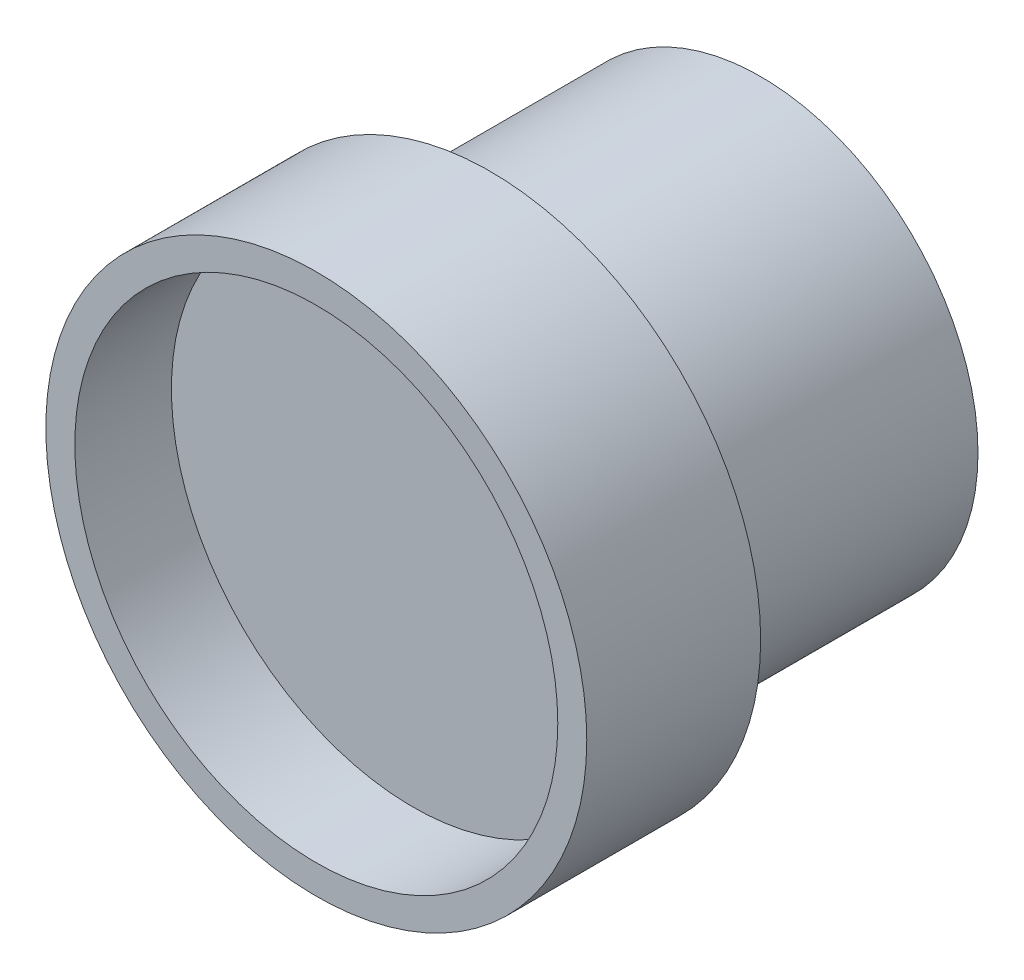
from build123d import *

# Parameters (mm, degrees)
ESQUISSE1_R             = 11.25
BASE_EXTRUSION_DEPTH    = 14
ESQUISSE2_R             = 14
BOSS_EXTRU_1_DEPTH      = 9
ESQUISSE3_R             = 12.5
ENL_V_MAT_EXTRU_1_DEPTH = 5


with BuildPart() as part:
    # Esquisse1 → Base-Extrusion (new body)
    with BuildSketch(Plane.XY):
        Circle(ESQUISSE1_R)
    extrude(amount=BASE_EXTRUSION_DEPTH)

    # Esquisse2 → Boss.-Extru.1 (add)
    with BuildSketch(Plane.XY.offset(14)):
        Circle(ESQUISSE2_R)
    extrude(amount=BOSS_EXTRU_1_DEPTH)

    # Esquisse3 → Enlèv. mat.-Extru.1 (cut)
    with BuildSketch(Plane.XY.offset(23)):
        Circle(ESQUISSE3_R)
    extrude(amount=-ENL_V_MAT_EXTRU_1_DEPTH, mode=Mode.SUBTRACT)


solid = part.part
